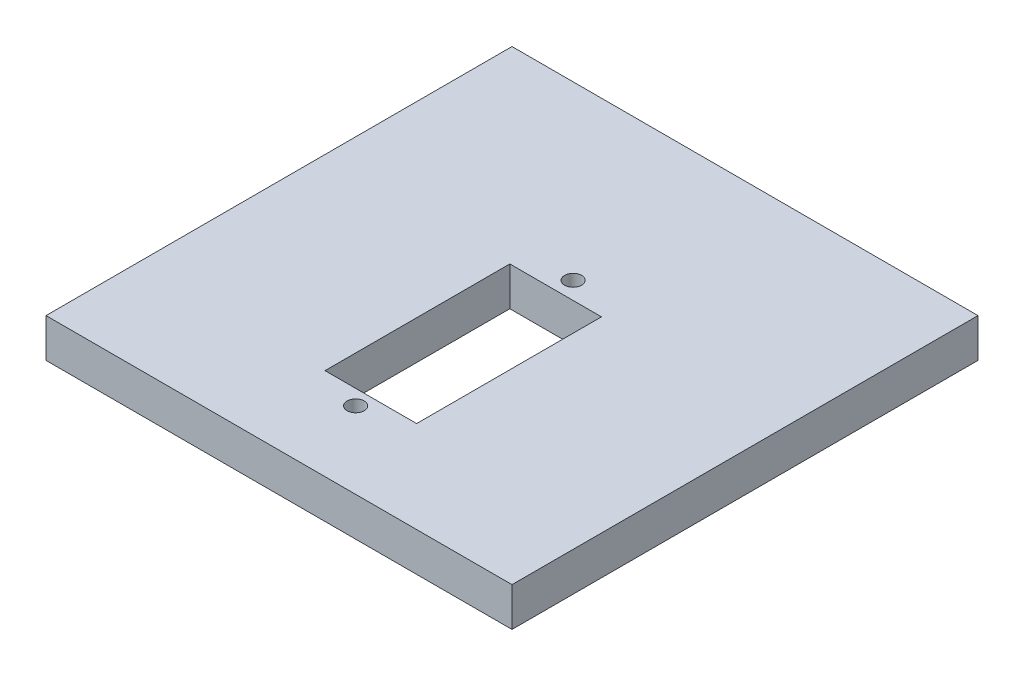
from build123d import *

# Parameters (mm, degrees)
EXTRUDE_1_DEPTH = 5


with BuildPart() as part:
    # 草图1 → 凸台-拉伸1 (new body)
    with BuildSketch(Plane(origin=(0, 0, 0), x_dir=(1, 0, 0), z_dir=(0, 1, 0))):
        Polygon((30, -20.08), (30, 0), (0, 0), (0, -60), (30, -60), (30, -52.18), (24.1, -52.18), (24.1, -48.18), (24.1, -24.38), (24.1, -20.08), align=None)
        Polygon((60, 0), (30, 0), (30, -20.08), (35.9, -20.08), (35.9, -24.38), (35.9, -48.18), (35.9, -52.18), (30, -52.18), (30, -60), (60, -60), align=None)
        with BuildLine():
            Line((30, -48.18), (24.1, -48.18))
            Line((24.1, -48.18), (24.1, -52.18))
            Line((24.1, -52.18), (30, -52.18))
            Line((30, -52.18), (30, -51.23))
            ThreePointArc((30, -51.23), (28.9, -50.13), (30, -49.03))
            Line((30, -49.03), (30, -48.18))
        make_face()
        with BuildLine():
            Line((35.9, -52.18), (35.9, -48.18))
            Line((35.9, -48.18), (30, -48.18))
            Line((30, -48.18), (30, -49.03))
            ThreePointArc((30, -49.03), (30.777817459, -49.352182541), (31.1, -50.13))
            ThreePointArc((31.1, -50.13), (30.777817459, -50.907817459), (30, -51.23))
            Line((30, -51.23), (30, -52.18))
            Line((30, -52.18), (35.9, -52.18))
        make_face()
        with BuildLine():
            Line((30, -21.03), (30, -20.08))
            Line((30, -20.08), (24.1, -20.08))
            Line((24.1, -20.08), (24.1, -24.38))
            Line((24.1, -24.38), (30, -24.38))
            Line((30, -24.38), (30, -23.23))
            ThreePointArc((30, -23.23), (28.9, -22.13), (30, -21.03))
        make_face()
        with BuildLine():
            Line((35.9, -20.08), (30, -20.08))
            Line((30, -20.08), (30, -21.03))
            ThreePointArc((30, -21.03), (30.777817459, -21.352182541), (31.1, -22.13))
            ThreePointArc((31.1, -22.13), (30.777817459, -22.907817459), (30, -23.23))
            Line((30, -23.23), (30, -24.38))
            Line((30, -24.38), (35.9, -24.38))
            Line((35.9, -24.38), (35.9, -20.08))
        make_face()
    extrude(amount=EXTRUDE_1_DEPTH)


solid = part.part
